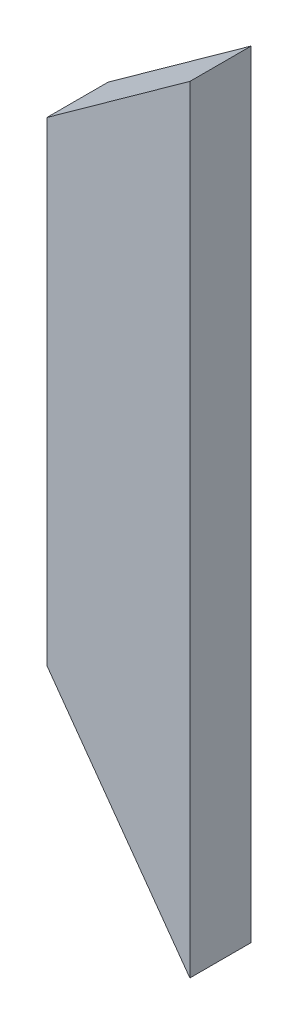
from build123d import *

# Parameters (mm, degrees)
BOSS_EXTRUDE1_DEPTH = 38.1


with BuildPart() as part:
    # Sketch1 → Boss-Extrude1 (new body)
    with BuildSketch(Plane.XY):
        Polygon((44.45, -241.3), (44.45, 241.3), (-44.45, 177.414581664), (-44.45, -117.515711821), align=None)
    extrude(amount=BOSS_EXTRUDE1_DEPTH)


solid = part.part
